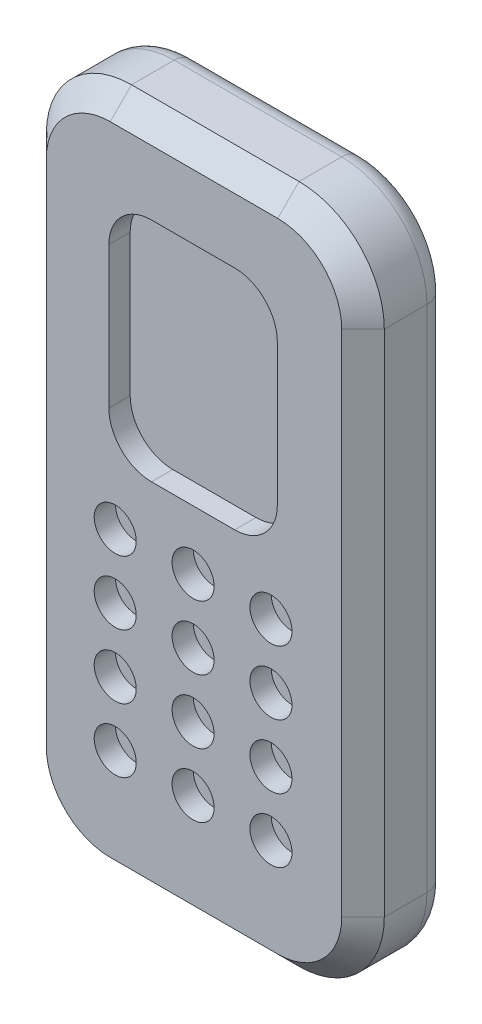
from build123d import *

# Parameters (mm, degrees)
EXTRUDE1_DEPTH = 10.16
CHAMFER1_SIZE  = 2.54
FILLET1_R      = 2.54
SKETCH2_R      = 2.50622178
SKETCH2_W      = 20.082955398
SKETCH2_H      = 27.0305724
EXTRUDE2_DEPTH = 2.54
FILLET2_R      = 5.08


with BuildPart() as part:
    # Sketch1 → Extrude1 (new body)
    with BuildSketch(Plane.XY):
        with BuildLine():
            Line((10.16, 0), (30.130017372, 0))
            ThreePointArc((30.130017372, 0), (37.314222268, 2.975795103), (40.290017372, 10.16))
            Line((40.290017372, 10.16), (40.290017372, 70.869919512))
            ThreePointArc((40.290017372, 70.869919512), (37.314222268, 78.054124409), (30.130017372, 81.029919512))
            Line((30.130017372, 81.029919512), (10.16, 81.029919512))
            ThreePointArc((10.16, 81.029919512), (2.975795103, 78.054124409), (0, 70.869919512))
            Line((0, 70.869919512), (0, 10.16))
            ThreePointArc((0, 10.16), (2.975795103, 2.975795103), (10.16, 0))
        make_face()
    extrude(amount=EXTRUDE1_DEPTH)

    # Chamfer1
    chamfer1_edges = [part.edges().sort_by_distance(p)[0] for p in [
        (2.975795103, 2.975795103, 10.16),
        (20.145008686, 0, 10.16),
        (37.314222268, 2.975795103, 10.16),
        (40.290017372, 40.514959756, 10.16),
        (37.314222268, 78.054124409, 10.16),
        (20.145008686, 81.029919512, 10.16),
        (2.975795103, 78.054124409, 10.16),
        (0, 40.514959756, 10.16),
    ]]
    chamfer(chamfer1_edges, length=CHAMFER1_SIZE)

    # Fillet1
    fillet1_edges = [part.edges().sort_by_distance(p)[0] for p in [
        (0, 40.514959756, 0),
        (2.975795103, 78.054124409, 0),
        (20.145008686, 81.029919512, 0),
        (37.314222268, 78.054124409, 0),
        (40.290017372, 40.514959756, 0),
        (37.314222268, 2.975795103, 0),
        (20.145008686, 0, 0),
        (2.975795103, 2.975795103, 0),
    ]]
    fillet(fillet1_edges, radius=FILLET1_R)

    # Sketch2 → Extrude2 (cut)
    with BuildSketch(Plane.XY.offset(10.16)):
        with Locations((10.754870081, 36.715481708)):
            Circle(SKETCH2_R)
        with Locations((20.03645217, 36.715481708)):
            Circle(SKETCH2_R)
        with Locations((29.318034259, 36.715481708)):
            Circle(SKETCH2_R)
        with Locations((10.754870081, 29.095481708)):
            Circle(SKETCH2_R)
        with Locations((20.03645217, 29.095481708)):
            Circle(SKETCH2_R)
        with Locations((29.318034259, 29.095481708)):
            Circle(SKETCH2_R)
        with Locations((10.754870081, 21.475481708)):
            Circle(SKETCH2_R)
        with Locations((20.03645217, 21.475481708)):
            Circle(SKETCH2_R)
        with Locations((29.318034259, 21.475481708)):
            Circle(SKETCH2_R)
        with Locations((10.754870081, 13.855481708)):
            Circle(SKETCH2_R)
        with Locations((20.03645217, 13.855481708)):
            Circle(SKETCH2_R)
        with Locations((29.318034259, 13.855481708)):
            Circle(SKETCH2_R)
        with Locations((20.03645217, 57.286941426)):
            Rectangle(SKETCH2_W, SKETCH2_H)
    extrude(amount=-EXTRUDE2_DEPTH, mode=Mode.SUBTRACT)

    # Fillet2
    fillet2_edges = [part.edges().sort_by_distance(p)[0] for p in [
        (9.994974471, 43.771655226, 8.89),
        (9.994974471, 70.802227626, 8.89),
        (30.077929869, 70.802227626, 8.89),
        (30.077929869, 43.771655226, 8.89),
    ]]
    fillet(fillet2_edges, radius=FILLET2_R)


solid = part.part
